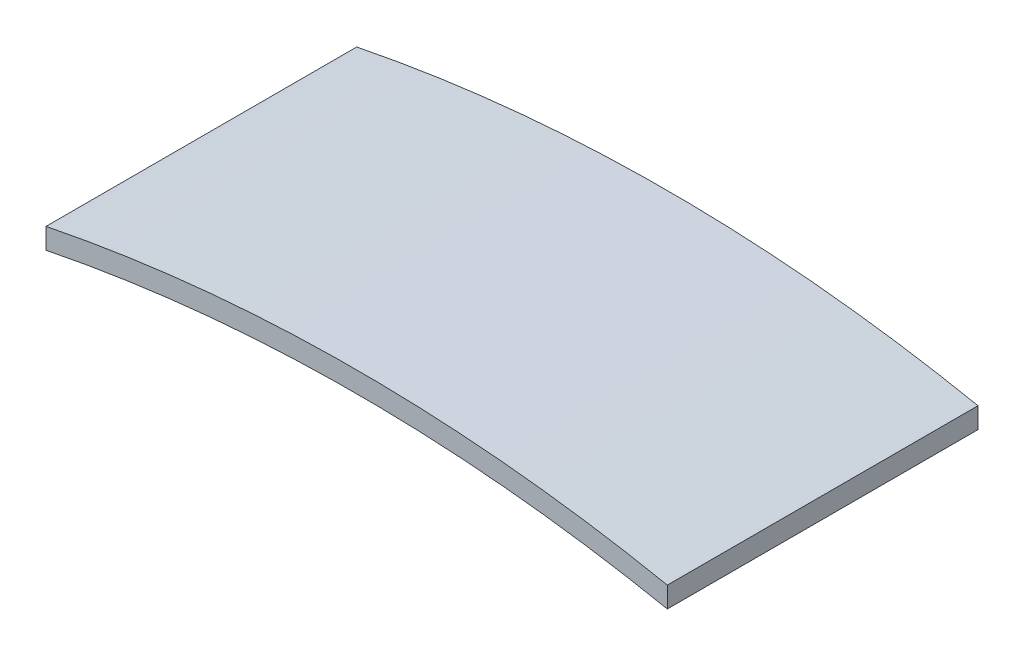
from build123d import *

# Parameters (mm, degrees)
TEST_L300_W150_RISE15_VERTICAL_T10_DEPTH = 150


with BuildPart() as part:
    # 草图1 → TEST_L300_W150_RISE15_VERTICAL_T10 (new body)
    with BuildSketch(Plane.XY):
        with BuildLine():
            Line((150, 115), (150, 125))
            ThreePointArc((150, 125), (0, 140), (-150, 125))
            Line((-150, 125), (-150, 115))
            ThreePointArc((-150, 115), (0, 130), (150, 115))
        make_face()
    extrude(amount=TEST_L300_W150_RISE15_VERTICAL_T10_DEPTH)


solid = part.part
